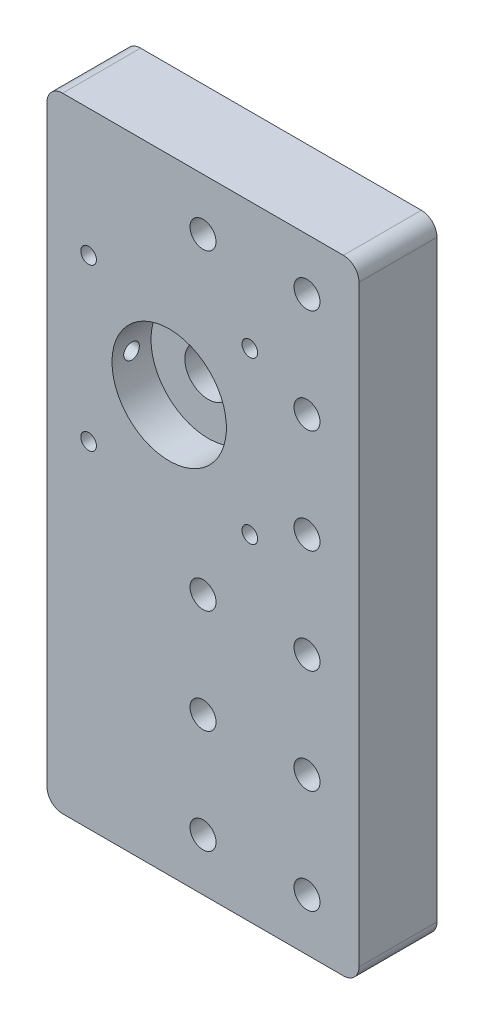
from build123d import *

# Parameters (mm, degrees)
SKETCH1_W           = 60
SKETCH1_H           = 120
SKETCH1_R           = 2.5
BOSS_EXTRUDE1_DEPTH = 15
FILLET1_R           = 3
SKETCH2_R           = 1.5
SKETCH2_R_2         = 4.5
CUT_EXTRUDE1_DEPTH  = 136
SKETCH2_3_R         = 11
SKETCH2_3_R_2       = 4.5
CUT_EXTRUDE2_DEPTH  = 7.5
CUT_EXTRUDE3_REACH  = 137
SKETCH3_R           = 1.5


with BuildPart() as part:
    # Sketch1 → Boss-Extrude1 (new body)
    with BuildSketch(Plane.XY):
        with Locations((30, 60)):
            Rectangle(SKETCH1_W, SKETCH1_H)
        with Locations((10, 110)):
            Circle(SKETCH1_R, mode=Mode.SUBTRACT)
        with Locations((30, 110)):
            Circle(SKETCH1_R, mode=Mode.SUBTRACT)
        with Locations((10, 90)):
            Circle(SKETCH1_R, mode=Mode.SUBTRACT)
        with Locations((10, 70)):
            Circle(SKETCH1_R, mode=Mode.SUBTRACT)
        with Locations((10, 10)):
            Circle(SKETCH1_R, mode=Mode.SUBTRACT)
        with Locations((30, 10)):
            Circle(SKETCH1_R, mode=Mode.SUBTRACT)
        with Locations((30, 50)):
            Circle(SKETCH1_R, mode=Mode.SUBTRACT)
        with Locations((10, 50)):
            Circle(SKETCH1_R, mode=Mode.SUBTRACT)
        with Locations((10, 30)):
            Circle(SKETCH1_R, mode=Mode.SUBTRACT)
        with Locations((30, 30)):
            Circle(SKETCH1_R, mode=Mode.SUBTRACT)
    extrude(amount=BOSS_EXTRUDE1_DEPTH)

    # Fillet1
    fillet1_edges = [part.edges().sort_by_distance(p)[0] for p in [
        (0, 0, 7.5),
        (60, 0, 7.5),
        (0, 120, 7.5),
        (60, 120, 7.5),
    ]]
    fillet(fillet1_edges, radius=FILLET1_R)

    # Sketch2 → Cut-Extrude1 (cut, through all)
    with BuildSketch(Plane.XY.offset(15)):
        with Locations((21, 95.5)):
            Circle(SKETCH2_R)
        with Locations((52, 95.5)):
            Circle(SKETCH2_R)
        with Locations((52, 64.5)):
            Circle(SKETCH2_R)
        with Locations((21, 64.5)):
            Circle(SKETCH2_R)
        with Locations((36.5, 80)):
            Circle(SKETCH2_R_2)
    extrude(amount=-CUT_EXTRUDE1_DEPTH, mode=Mode.SUBTRACT)

    # Sketch2<3> → Cut-Extrude2 (cut)
    with BuildSketch(Plane.XY.offset(15)):
        with Locations((36.5, 80)):
            Circle(SKETCH2_3_R)
        with Locations((36.5, 80)):
            Circle(SKETCH2_3_R_2, mode=Mode.SUBTRACT)
    extrude(amount=-CUT_EXTRUDE2_DEPTH, mode=Mode.SUBTRACT)


with BuildPart() as body_2:
    # Mirror1: mirrored copy
    add(part.part.mirror(Plane(origin=(60, 0, 15), x_dir=(0, 0, 1), z_dir=(-1, 0, 0))))

    # Sketch3 → Cut-Extrude3 (cut, up to next)
    with BuildSketch(Plane.ZY.offset(-60), mode=Mode.PRIVATE) as cut_extrude3_sk1:
        with Locations((11.25, 80)):
            Circle(SKETCH3_R)
    cut_extrude3_tool1 = extrude(cut_extrude3_sk1.sketch, amount=-CUT_EXTRUDE3_REACH, mode=Mode.PRIVATE) & body_2.part
    add(cut_extrude3_tool1.solids().sort_by_distance((60, 80, 11.25))[0], mode=Mode.SUBTRACT)


solid = body_2.part
